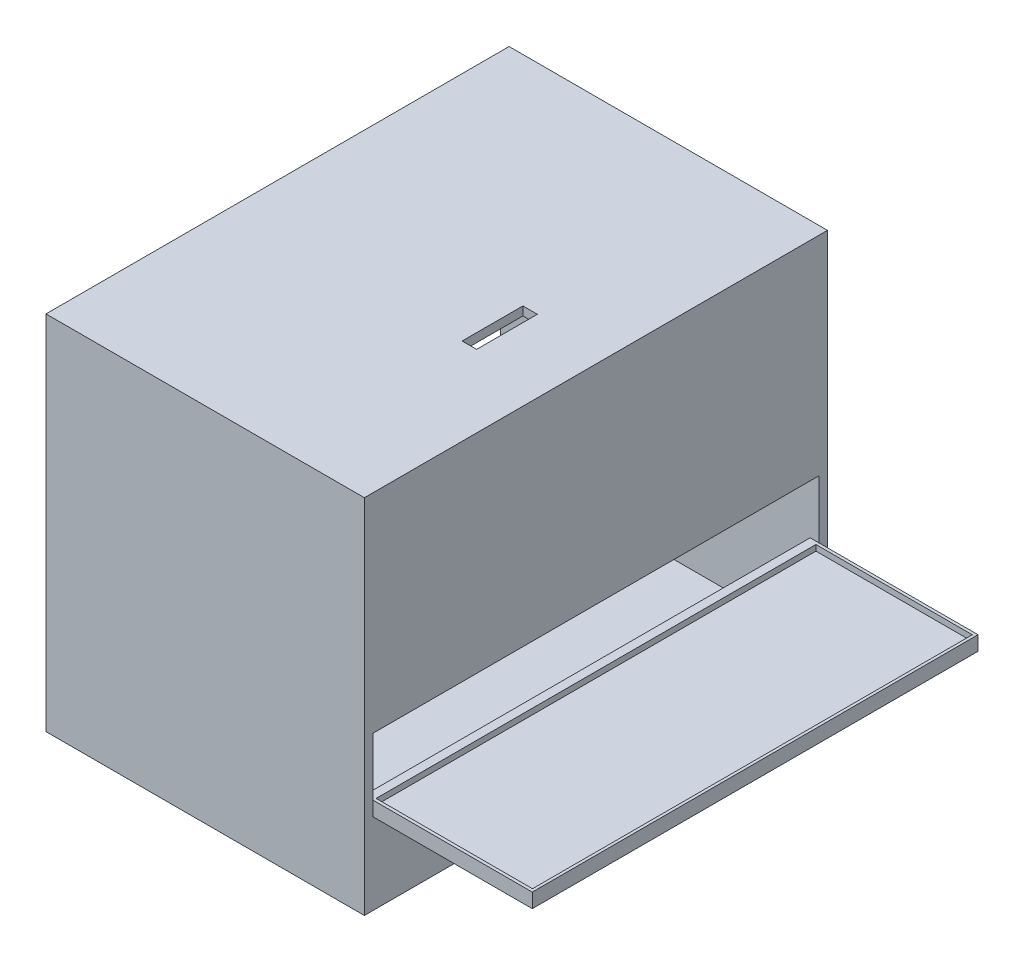
from build123d import *

# Parameters (mm, degrees)
ESBO_O1_W                   = 110
ESBO_O1_H                   = 160
RESSALTO_EXTRUS_O1_DEPTH    = 10
ESBO_O2_W                   = 95
ESBO_O2_H                   = 140
CORTE_EXTRUS_O1_DEPTH       = 2
RESSALTO_EXTRUS_O2_DEPTH    = 110
ESBO_O6_W                   = 25.003576957
ESBO_O6_H                   = 20
CORTE_EXTRUS_O2_DEPTH       = 10
ESBO_O7_W                   = 140
ESBO_O7_H                   = 20.035722947
SAIDAPRAFIOSSENSORES_DEPTH  = 30
ESBO_O8_W                   = 140
ESBO_O8_H                   = 9.973523328
SUPORTE_PARA_SENSORES_DEPTH = 55
ESBO_O9_W                   = 55
ESBO_O9_H                   = 140
CORTE_EXTRUS_O4_DEPTH       = 2
ESBO_O5_W                   = 110
ESBO_O5_H                   = 160
RESSALTO_EXTRUS_O3_DEPTH    = 10
ESBO_O11_W                  = 5
ESBO_O11_H                  = 21
CORTE_EXTRUS_O5_DEPTH       = 9
ESBO_O12_W                  = 102.5
ESBO_O12_H                  = 140
CORTE_EXTRUS_O6_DEPTH       = 7
CORTE_EXTRUS_O7_DEPTH       = 7
CORTE_EXTRUS_O8_DEPTH       = 7
ESBO_O15_W                  = 110
ESBO_O15_H                  = 160
CORTE_EXTRUS_O9_DEPTH       = 5
ESBO_O16_W                  = 154
ESBO_O16_H                  = 119
CORTE_EXTRUS_O10_DEPTH      = 4.5
ESBO_O17_W                  = 55
ESBO_O17_H                  = 140
CORTE_EXTRUS_O11_DEPTH      = 5
ESBO_O18_W                  = 55
ESBO_O18_H                  = 2.973523328
RESSALTO_EXTRUS_O4_DEPTH    = 7
ESBO_O19_W                  = 55
ESBO_O19_H                  = 2.973523328
RESSALTO_EXTRUS_O5_DEPTH    = 7
RESSALTO_EXTRUS_O6_DEPTH    = 2


with BuildPart() as part:
    # Esboço1 → Ressalto-extrusão1 (new body)
    with BuildSketch(Plane(origin=(0, 0, 0), x_dir=(1, 0, 0), z_dir=(0, 1, 0))):
        with Locations((55, 80)):
            Rectangle(ESBO_O1_W, ESBO_O1_H)
    extrude(amount=RESSALTO_EXTRUS_O1_DEPTH)

    # Esboço2 → Corte-extrusão1 (cut)
    with BuildSketch(Plane(origin=(0, 10, 0), x_dir=(1, 0, 0), z_dir=(0, 1, 0))):
        with Locations((55, 80)):
            Rectangle(ESBO_O2_W, ESBO_O2_H)
    extrude(amount=-CORTE_EXTRUS_O1_DEPTH, mode=Mode.SUBTRACT)

    # Esboço4 → Ressalto-extrusão2 (add)
    with BuildSketch(Plane(origin=(0, 10, 0), x_dir=(1, 0, 0), z_dir=(0, 1, 0))):
        Polygon((0, 160), (0, 150), (102.5, 150), (102.5, 10), (0, 10), (0, 0), (110, 0), (110, 160), align=None)
    extrude(amount=RESSALTO_EXTRUS_O2_DEPTH)

    # Esboço6 → Corte-extrusão2 (cut)
    with BuildSketch(Plane.XY.offset(-150)):
        with Locations((45.020695382, 18)):
            Rectangle(ESBO_O6_W, ESBO_O6_H)
    extrude(amount=-CORTE_EXTRUS_O2_DEPTH, mode=Mode.SUBTRACT)

    # Esboço7 → Saidaprafiossensores (cut)
    with BuildSketch(Plane.ZY.offset(-102.5)):
        with Locations((-80, 48.022769051)):
            Rectangle(ESBO_O7_W, ESBO_O7_H)
    extrude(amount=-SAIDAPRAFIOSSENSORES_DEPTH, mode=Mode.SUBTRACT)

    # Esboço8 → Suporte para sensores (add)
    with BuildSketch(Plane(origin=(110, 0, 0), x_dir=(0, 0, -1), z_dir=(1, 0, 0))):
        with Locations((80, 33.018145913)):
            Rectangle(ESBO_O8_W, ESBO_O8_H)
    extrude(amount=SUPORTE_PARA_SENSORES_DEPTH)

    # Esboço9 → Corte-extrusão4 (cut)
    with BuildSketch(Plane(origin=(0, 38.004907577, 0), x_dir=(1, 0, 0), z_dir=(0, 1, 0))):
        with Locations((137.5, 80)):
            Rectangle(ESBO_O9_W, ESBO_O9_H)
    extrude(amount=-CORTE_EXTRUS_O4_DEPTH, mode=Mode.SUBTRACT)

    # Esboço5 → Ressalto-extrusão3 (add)
    with BuildSketch(Plane(origin=(0, 120, 0), x_dir=(1, 0, 0), z_dir=(0, 1, 0))):
        with Locations((55, 80)):
            Rectangle(ESBO_O5_W, ESBO_O5_H)
    extrude(amount=RESSALTO_EXTRUS_O3_DEPTH)

    # Esboço11 → Corte-extrusão5 (cut)
    with BuildSketch(Plane(origin=(0, 130, 0), x_dir=(1, 0, 0), z_dir=(0, 1, 0))):
        with Locations((82.5, 74.263561318)):
            Rectangle(ESBO_O11_W, ESBO_O11_H)
    extrude(amount=-CORTE_EXTRUS_O5_DEPTH, mode=Mode.SUBTRACT)

    # Esboço12 → Corte-extrusão6 (cut)
    with BuildSketch(Plane.XZ.offset(-120)):
        with Locations((51.25, -80)):
            Rectangle(ESBO_O12_W, ESBO_O12_H)
    extrude(amount=-CORTE_EXTRUS_O6_DEPTH, mode=Mode.SUBTRACT)

    # Esboço13 → Corte-extrusão7 (cut)
    with BuildSketch(Plane.XY.offset(-150)):
        Polygon((7.5, 8), (7.5, 10), (0, 10), (0, 127), (102.5, 127), (102.5, 58.040630524), (110, 58.040630524), (110, 38.004907577), (102.5, 38.004907577), (102.5, 8), align=None)
    extrude(amount=-CORTE_EXTRUS_O7_DEPTH, mode=Mode.SUBTRACT)

    # Esboço14 → Corte-extrusão8 (cut)
    with BuildSketch(Plane(origin=(0, 0, -10), x_dir=(-1, 0, 0), z_dir=(0, 0, -1))):
        Polygon((-102.5, 127), (0, 127), (0, 10), (-7.5, 10), (-7.5, 8), (-102.5, 8), (-102.5, 38.004907577), (-110, 38.004907577), (-110, 58.040630524), (-102.5, 58.040630524), align=None)
    extrude(amount=-CORTE_EXTRUS_O8_DEPTH, mode=Mode.SUBTRACT)

    # Esboço15 → Corte-extrusão9 (cut)
    with BuildSketch(Plane.XZ):
        with Locations((55, -80)):
            Rectangle(ESBO_O15_W, ESBO_O15_H)
    extrude(amount=-CORTE_EXTRUS_O9_DEPTH, mode=Mode.SUBTRACT)

    # Esboço16 → Corte-extrusão10 (cut)
    with BuildSketch(Plane.ZY.offset(-102.5)):
        with Locations((-80, 67.5)):
            Rectangle(ESBO_O16_W, ESBO_O16_H)
    extrude(amount=-CORTE_EXTRUS_O10_DEPTH, mode=Mode.SUBTRACT)

    # Esboço17 → Corte-extrusão11 (cut)
    with BuildSketch(Plane.XZ.offset(-28.031384249)):
        with Locations((137.5, -80)):
            Rectangle(ESBO_O17_W, ESBO_O17_H)
    extrude(amount=-CORTE_EXTRUS_O11_DEPTH, mode=Mode.SUBTRACT)

    # Esboço18 → Ressalto-extrusão4 (add)
    with BuildSketch(Plane.XY.offset(-10)):
        with Locations((137.5, 34.518145913)):
            Rectangle(ESBO_O18_W, ESBO_O18_H)
    extrude(amount=RESSALTO_EXTRUS_O4_DEPTH)

    # Esboço19 → Ressalto-extrusão5 (add)
    with BuildSketch(Plane(origin=(0, 0, -150), x_dir=(-1, 0, 0), z_dir=(0, 0, -1))):
        with Locations((-137.5, 34.518145913)):
            Rectangle(ESBO_O19_W, ESBO_O19_H)
    extrude(amount=RESSALTO_EXTRUS_O5_DEPTH)

    # Esboço20 → Ressalto-extrusão6 (add)
    with BuildSketch(Plane(origin=(0, 36.004907577, 0), x_dir=(1, 0, 0), z_dir=(0, 1, 0))):
        Polygon((110, 157), (110, 156.007066328), (164.030852529, 156.007066328), (164.030852529, 4.050019812), (110, 4.050019812), (110, 3), (165, 3), (165, 157), align=None)
    extrude(amount=RESSALTO_EXTRUS_O6_DEPTH)


solid = part.part
